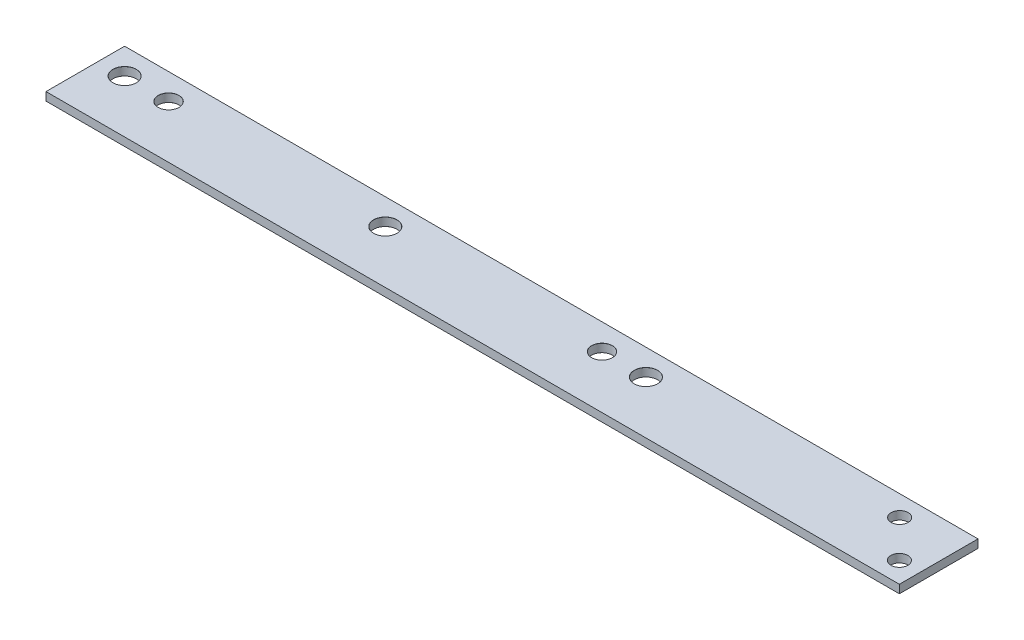
from build123d import *

# Parameters (mm, degrees)
SKETCH1_W                      = 330
SKETCH1_H                      = 30.4
BOSS_EXTRUDE1_DEPTH            = 3.2
M8_CLEARANCE_HOLE1_AT_2_COUNT  = 2
M8_CLEARANCE_HOLE1_AT_2_PITCH  = 201.6
M8_CLEARANCE_HOLE1_AT_3_COUNT  = 2
M8_CLEARANCE_HOLE1_AT_3_PITCH  = 100.8
F_8_0MM_DOWEL_HOLE1_AT_2_COUNT = 2
F_8_0MM_DOWEL_HOLE1_AT_2_PITCH = 167.6
M6_CLEARANCE_HOLE1_D           = 6.6


with BuildPart() as part:
    # Sketch1 → Boss-Extrude1 (new body)
    with BuildSketch(Plane(origin=(0, 0, 0), x_dir=(1, 0, 0), z_dir=(0, 1, 0))):
        Rectangle(SKETCH1_W, SKETCH1_H)
    extrude(amount=-BOSS_EXTRUDE1_DEPTH)

    # Sketch3 → M8 Clearance Hole1 (revolve, cut)
    with BuildSketch(Plane(origin=(-155, 0, -5.2), x_dir=(0, 0, 1), z_dir=(1, 0, 0))):
        Polygon((0, 0), (0, 3.2), (4.525, 3.2), (4.5, 3.175), (4.5, 0.025), (4.525, 0), align=None)
    m8_clearance_hole1 = revolve(axis=Axis((-155, 6.35, -5.2), (0, -1, 0)), mode=Mode.SUBTRACT)

    # M8 Clearance Hole1 at 2: M8 Clearance Hole1 ×2
    with Locations(*[(i * M8_CLEARANCE_HOLE1_AT_2_PITCH, 0, 0) for i in range(1, M8_CLEARANCE_HOLE1_AT_2_COUNT)]):
        add(m8_clearance_hole1, mode=Mode.SUBTRACT)

    # M8 Clearance Hole1 at 3: M8 Clearance Hole1 ×2
    with Locations(*[(i * M8_CLEARANCE_HOLE1_AT_3_PITCH, 0, 0) for i in range(1, M8_CLEARANCE_HOLE1_AT_3_COUNT)]):
        add(m8_clearance_hole1, mode=Mode.SUBTRACT)

    # Sketch5 → Ø8.0mm Dowel Hole1 (revolve, cut)
    with BuildSketch(Plane(origin=(-138, 0, -5.2), x_dir=(0, 0, 1), z_dir=(1, 0, 0))):
        Polygon((0, 0), (0, 3.2), (4.025, 3.2), (4, 3.175), (4, 0.025), (4.025, 0), align=None)
    f_8_0mm_dowel_hole1 = revolve(axis=Axis((-138, 6.35, -5.2), (0, -1, 0)), mode=Mode.SUBTRACT)

    # Ø8.0mm Dowel Hole1 at 2: Ø8.0mm Dowel Hole1 ×2
    with Locations(*[(i * F_8_0MM_DOWEL_HOLE1_AT_2_PITCH, 0, 0) for i in range(1, F_8_0MM_DOWEL_HOLE1_AT_2_COUNT)]):
        add(f_8_0mm_dowel_hole1, mode=Mode.SUBTRACT)

    # M6 Clearance Hole1 (through all)
    with Locations(Plane(origin=(0, 0, 0), x_dir=(1, 0, 0), z_dir=(0, 1, 0))):
        with Locations((142.7, 7.2), (157, -7.2)):
            Hole(M6_CLEARANCE_HOLE1_D / 2)


solid = part.part
